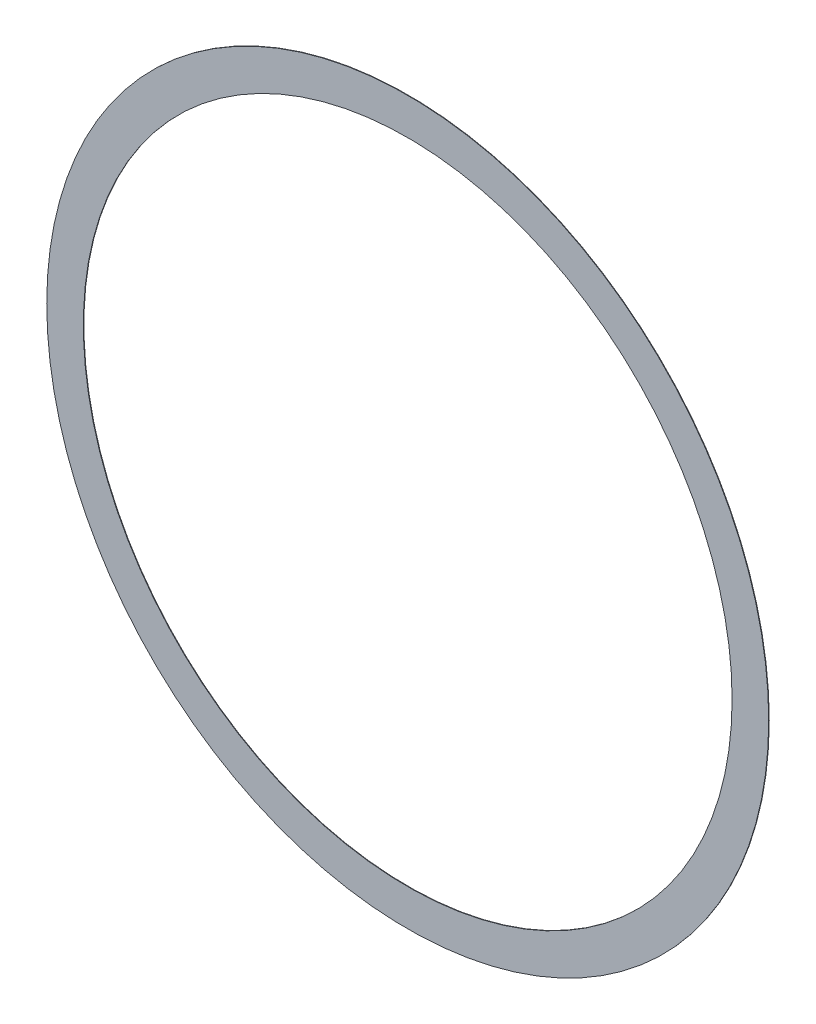
from build123d import *

# Parameters (mm, degrees)
SKETCH1_R           = 69
SKETCH1_R_2         = 62
BOSS_EXTRUDE1_DEPTH = 0.1


with BuildPart() as part:
    # Sketch1 → Boss-Extrude1 (new body)
    with BuildSketch(Plane.XY):
        Circle(SKETCH1_R)
        Circle(SKETCH1_R_2, mode=Mode.SUBTRACT)
    extrude(amount=BOSS_EXTRUDE1_DEPTH)


solid = part.part
